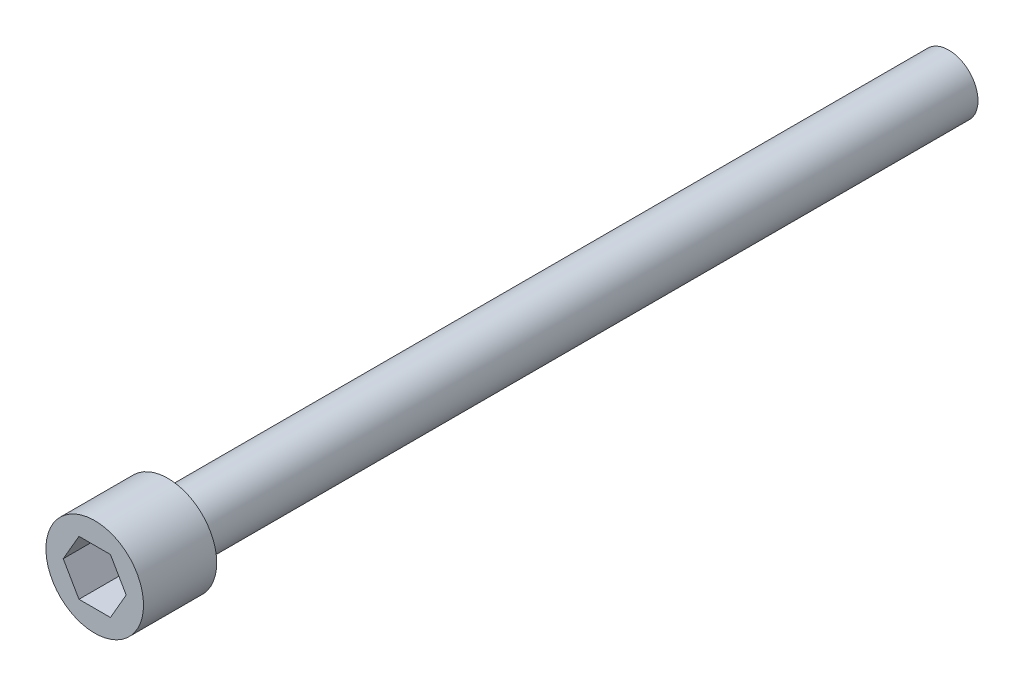
from build123d import *

# Parameters (mm, degrees)
SKETCH1_R           = 1.2
BOSS_EXTRUDE1_DEPTH = 32
SKETCH2_R           = 2
BOSS_EXTRUDE2_DEPTH = 3
CUT_EXTRUDE1_DEPTH  = 2


with BuildPart() as part:
    # Sketch1 → Boss-Extrude1 (new body)
    with BuildSketch(Plane.XY):
        with Locations((-15, 15)):
            Circle(SKETCH1_R)
    extrude(amount=-BOSS_EXTRUDE1_DEPTH)

    # Sketch2 → Boss-Extrude2 (add)
    with BuildSketch(Plane.XY):
        with Locations((-15, 15)):
            Circle(SKETCH2_R)
    extrude(amount=BOSS_EXTRUDE2_DEPTH)

    # Sketch3 → Cut-Extrude1 (cut)
    with BuildSketch(Plane.XY.offset(3)):
        Polygon((-13.709947687, 15), (-14.354973843, 16.117218076), (-15.645026157, 16.117218076), (-16.290052313, 15), (-15.645026157, 13.882781924), (-14.354973843, 13.882781924), align=None)
    extrude(amount=-CUT_EXTRUDE1_DEPTH, mode=Mode.SUBTRACT)


solid = part.part
